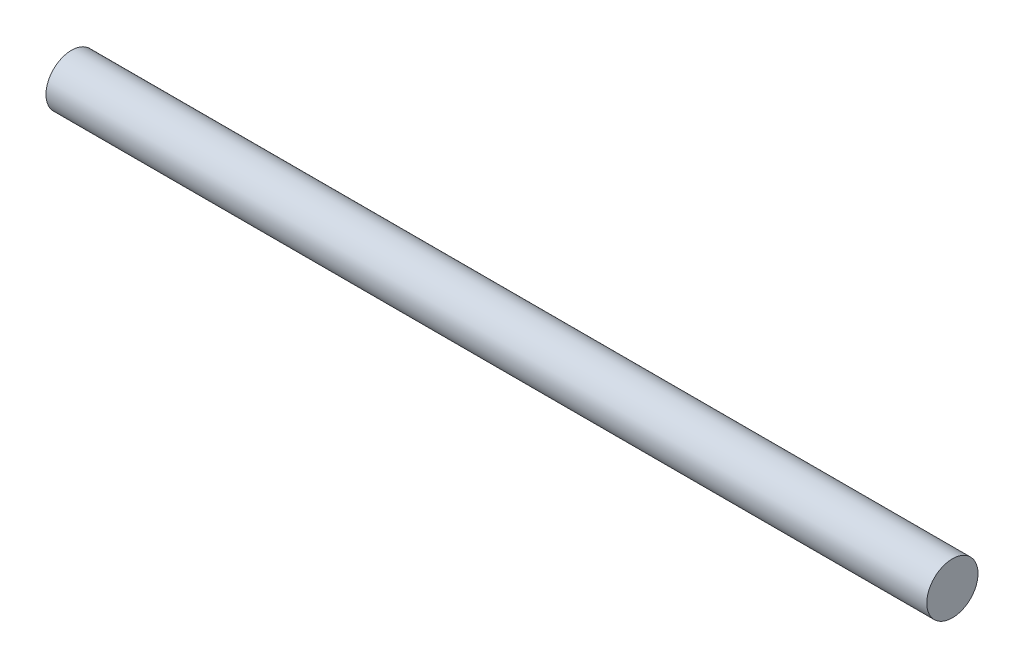
from build123d import *

# Parameters (mm, degrees)
SKETCH1_R           = 2.5
BOSS_EXTRUDE1_DEPTH = 86


with BuildPart() as part:
    # Sketch1 → Boss-Extrude1 (new body)
    with BuildSketch(Plane(origin=(0, 0, 0), x_dir=(0, 0, -1), z_dir=(1, 0, 0))):
        Circle(SKETCH1_R)
    extrude(amount=BOSS_EXTRUDE1_DEPTH)


solid = part.part
